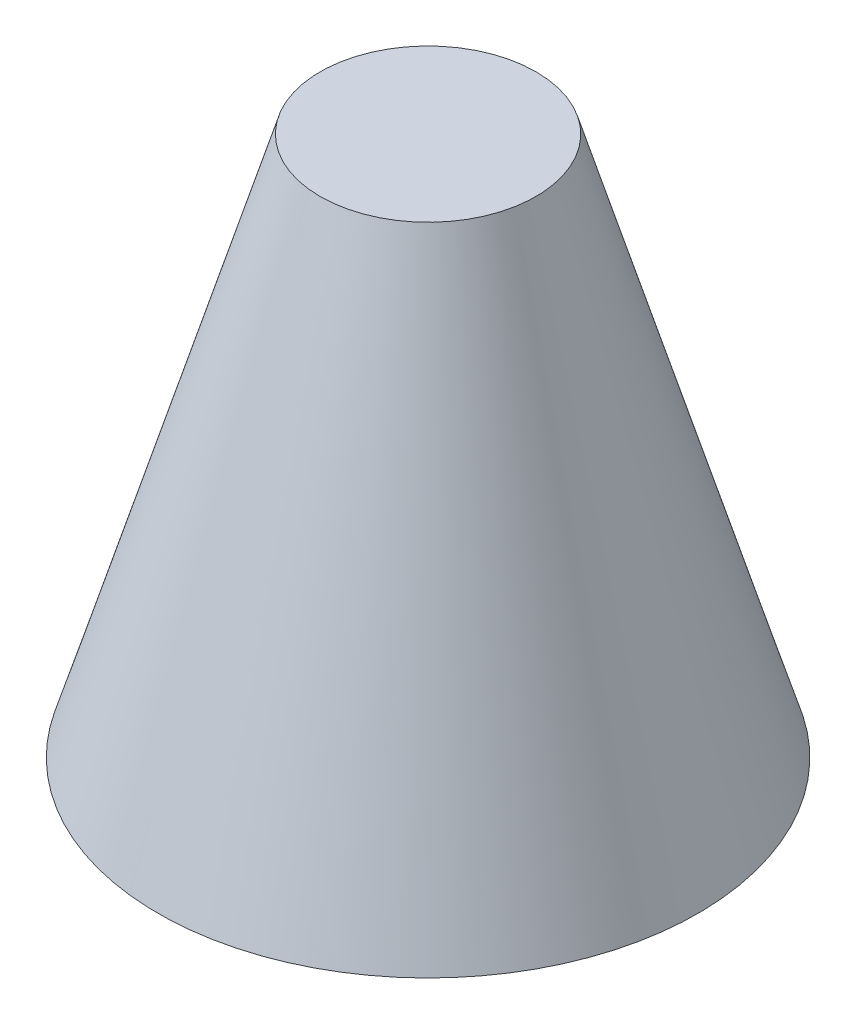
from build123d import *

# Parameters (mm, degrees)
CROQUIS_AGUJEROS_MONTAJE_R = 4
AGUJERO_INSERTO_M6_DEPTH   = 14


with BuildPart() as part:
    # Croquis_perfil → Tronco_cono (revolve)
    with BuildSketch(Plane.XY, mode=Mode.PRIVATE) as tronco_cono_sk:
        Polygon((0, 0), (50, 0), (20, 100), (0, 100), align=None)
    revolve(tronco_cono_sk.sketch.rotate(Axis((0, 0, 0), (0, 1, 0)), 90), axis=Axis((0, 0, 0), (0, 1, 0)))

    # Croquis_agujeros_montaje → Agujero_inserto_M6 (cut)
    with BuildSketch(Plane(origin=(0, 0, 0), x_dir=(1, 0, 0), z_dir=(0, 1, 0))):
        with Locations(Location((0, 0, 0), (0, 0, 270))):
            Circle(CROQUIS_AGUJEROS_MONTAJE_R)
    extrude(amount=AGUJERO_INSERTO_M6_DEPTH, mode=Mode.SUBTRACT)


solid = part.part
